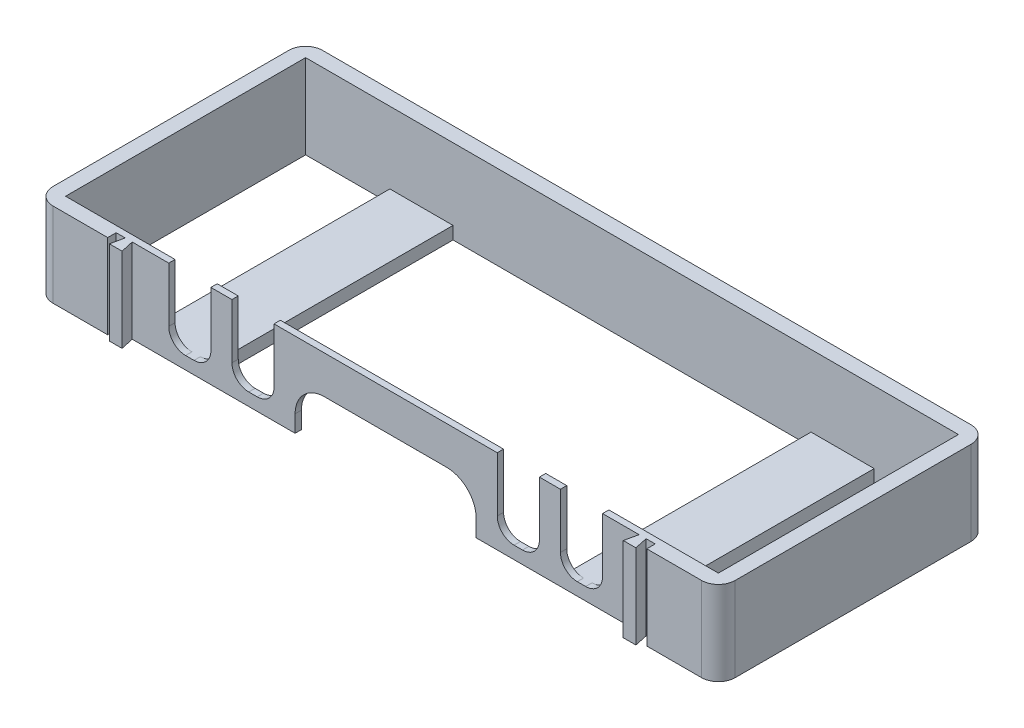
from build123d import *

# Parameters (mm, degrees)
SKETCH1_W           = 81
SKETCH1_H           = 32
BOSS_EXTRUDE1_DEPTH = 10
SKETCH2_W           = 77.5
SKETCH2_H           = 28.5
CUT_EXTRUDE1_DEPTH  = 10
SKETCH3_W           = 7.5
SKETCH3_H           = 32
BOSS_EXTRUDE2_DEPTH = 1.5
SKETCH4_W           = 64
SKETCH4_H           = 1
CUT_EXTRUDE2_DEPTH  = 10
BOSS_EXTRUDE3_DEPTH = 10
BOSS_EXTRUDE4_DEPTH = 10
FILLET1_R           = 2
FILLET2_R           = 2
FILLET3_R           = 2
FILLET4_R           = 2
CUT_EXTRUDE3_DEPTH  = 0.75
SKETCH8_W           = 21.5
SKETCH8_H           = 5.5
CUT_EXTRUDE4_DEPTH  = 0.75
FILLET5_R           = 3.5
FILLET6_R           = 3.5


with BuildPart() as part:
    # Sketch1 → Boss-Extrude1 (new body)
    with BuildSketch(Plane(origin=(0, 0, 0), x_dir=(1, 0, 0), z_dir=(0, 1, 0))):
        with Locations((-86.056207425, -60.23876691)):
            Rectangle(SKETCH1_W, SKETCH1_H)
    extrude(amount=BOSS_EXTRUDE1_DEPTH)

    # Sketch2 → Cut-Extrude1 (cut)
    with BuildSketch(Plane(origin=(0, 10, 0), x_dir=(1, 0, 0), z_dir=(0, 1, 0))):
        with Locations((-86.056207425, -60.23876691)):
            Rectangle(SKETCH2_W, SKETCH2_H)
    extrude(amount=-CUT_EXTRUDE1_DEPTH, mode=Mode.SUBTRACT)

    # Sketch3 → Boss-Extrude2 (add)
    with BuildSketch(Plane(origin=(0, 0, 0), x_dir=(-1, 0, 0), z_dir=(0, -1, 0))):
        with Locations((61.056207425, -60.23876691)):
            Rectangle(SKETCH3_W, SKETCH3_H)
        with Locations((111.056207425, -60.23876691)):
            Rectangle(SKETCH3_W, SKETCH3_H)
    extrude(amount=-BOSS_EXTRUDE2_DEPTH)

    # Sketch4 → Cut-Extrude2 (cut)
    with BuildSketch(Plane(origin=(0, 10, 0), x_dir=(1, 0, 0), z_dir=(0, 1, 0))):
        with Locations((-86.056207425, -75.73876691)):
            Rectangle(SKETCH4_W, SKETCH4_H)
    extrude(amount=-CUT_EXTRUDE2_DEPTH, mode=Mode.SUBTRACT)

    # Sketch5 → Boss-Extrude3 (add)
    with BuildSketch(Plane(origin=(0, 10, 0), x_dir=(1, 0, 0), z_dir=(0, 1, 0))):
        Polygon((-116.976207425, -75.23876691), (-117.306207425, -76.781751031), (-115.806207425, -76.781751031), (-116.146207425, -75.23876691), align=None)
    extrude(amount=-BOSS_EXTRUDE3_DEPTH)

    # Sketch6 → Boss-Extrude4 (add)
    with BuildSketch(Plane(origin=(0, 10, 0), x_dir=(1, 0, 0), z_dir=(0, 1, 0))):
        Polygon((-55.966207425, -75.23876691), (-56.306207425, -76.781751031), (-54.806207425, -76.781751031), (-55.136207425, -75.23876691), align=None)
    extrude(amount=-BOSS_EXTRUDE4_DEPTH)

    # Fillet1
    fillet1_edges = [part.edges().sort_by_distance(p)[0] for p in [
        (-126.556207425, 5, 76.23876691),
    ]]
    fillet(fillet1_edges, radius=FILLET1_R)

    # Fillet2
    fillet2_edges = [part.edges().sort_by_distance(p)[0] for p in [
        (-45.556207425, 5, 76.23876691),
    ]]
    fillet(fillet2_edges, radius=FILLET2_R)

    # Fillet3
    fillet3_edges = [part.edges().sort_by_distance(p)[0] for p in [
        (-45.556207425, 5, 44.23876691),
    ]]
    fillet(fillet3_edges, radius=FILLET3_R)

    # Fillet4
    fillet4_edges = [part.edges().sort_by_distance(p)[0] for p in [
        (-126.556207425, 5, 44.23876691),
    ]]
    fillet(fillet4_edges, radius=FILLET4_R)

    # Sketch7 → Cut-Extrude3 (cut)
    with BuildSketch(Plane.XY.offset(75.23876691)):
        with BuildLine():
            Line((-111.806207425, 10), (-106.806207425, 10))
            Line((-106.806207425, 10), (-106.806207425, 3.5))
            ThreePointArc((-106.806207425, 3.5), (-107.391993862, 2.085786438), (-108.806207425, 1.5))
            Line((-108.806207425, 1.5), (-109.806207425, 1.5))
            ThreePointArc((-109.806207425, 1.5), (-111.220420987, 2.085786438), (-111.806207425, 3.5))
            Line((-111.806207425, 3.5), (-111.806207425, 10))
        make_face()
        with BuildLine():
            Line((-65.306207425, 10), (-60.306207425, 10))
            Line((-60.306207425, 10), (-60.306207425, 3.5))
            ThreePointArc((-60.306207425, 3.5), (-60.891993862, 2.085786438), (-62.306207425, 1.5))
            Line((-62.306207425, 1.5), (-63.306207425, 1.5))
            ThreePointArc((-63.306207425, 1.5), (-64.720420987, 2.085786438), (-65.306207425, 3.5))
            Line((-65.306207425, 3.5), (-65.306207425, 10))
        make_face()
        with BuildLine():
            Line((-104.306207425, 10), (-99.306207425, 10))
            Line((-99.306207425, 10), (-99.306207425, 3.5))
            ThreePointArc((-99.306207425, 3.5), (-99.891993862, 2.085786438), (-101.306207425, 1.5))
            Line((-101.306207425, 1.5), (-102.306207425, 1.5))
            ThreePointArc((-102.306207425, 1.5), (-103.720420987, 2.085786438), (-104.306207425, 3.5))
            Line((-104.306207425, 3.5), (-104.306207425, 10))
        make_face()
        with BuildLine():
            Line((-72.806207425, 10), (-67.806207425, 10))
            Line((-67.806207425, 10), (-67.806207425, 3.5))
            ThreePointArc((-67.806207425, 3.5), (-68.391993862, 2.085786438), (-69.806207425, 1.5))
            Line((-69.806207425, 1.5), (-70.806207425, 1.5))
            ThreePointArc((-70.806207425, 1.5), (-72.220420987, 2.085786438), (-72.806207425, 3.5))
            Line((-72.806207425, 3.5), (-72.806207425, 10))
        make_face()
    extrude(amount=-CUT_EXTRUDE3_DEPTH, mode=Mode.SUBTRACT)

    # Sketch8 → Cut-Extrude4 (cut)
    with BuildSketch(Plane.XY.offset(75.23876691)):
        with Locations((-86.056207425, 2.75)):
            Rectangle(SKETCH8_W, SKETCH8_H)
    extrude(amount=-CUT_EXTRUDE4_DEPTH, mode=Mode.SUBTRACT)

    # Fillet5
    fillet5_edges = [part.edges().sort_by_distance(p)[0] for p in [
        (-96.806207425, 5.5, 74.86376691),
    ]]
    fillet(fillet5_edges, radius=FILLET5_R)

    # Fillet6
    fillet6_edges = [part.edges().sort_by_distance(p)[0] for p in [
        (-75.306207425, 5.5, 74.86376691),
    ]]
    fillet(fillet6_edges, radius=FILLET6_R)


solid = part.part
